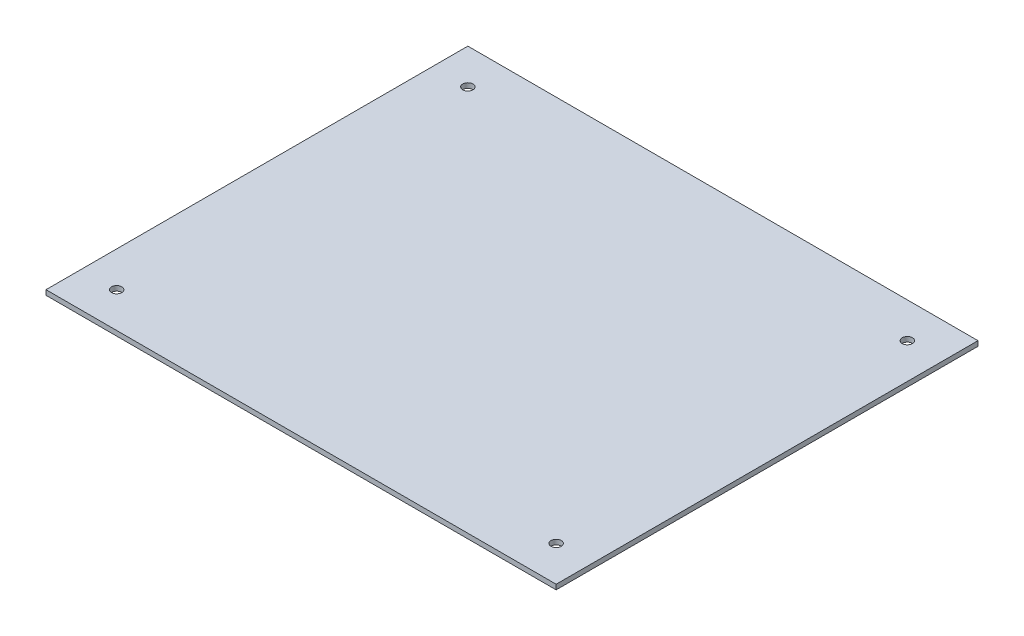
from build123d import *

# Parameters (mm, degrees)
SKETCH2_W           = 330.2
SKETCH2_H           = 273.05
BOSS_EXTRUDE1_DEPTH = 3.175
SKETCH3_R           = 3.302
CUT_EXTRUDE1_DEPTH  = 215.259576799


with BuildPart() as part:
    # Sketch2 → Boss-Extrude1 (new body)
    with BuildSketch(Plane(origin=(0, 0, 0), x_dir=(1, 0, 0), z_dir=(0, 1, 0))):
        Rectangle(SKETCH2_W, SKETCH2_H)
    extrude(amount=BOSS_EXTRUDE1_DEPTH)

    # Sketch3 → Cut-Extrude1 (cut, through all)
    with BuildSketch(Plane(origin=(0, 3.175, 0), x_dir=(1, 0, 0), z_dir=(0, 1, 0))):
        with Locations(Location((-142.24, -113.665, 0), (0, 0, 270))):
            Circle(SKETCH3_R)
        with Locations(Location((-142.24, 113.665, 0), (0, 0, 270))):
            Circle(SKETCH3_R)
        with Locations(Location((142.24, -113.665, 0), (0, 0, 270))):
            Circle(SKETCH3_R)
        with Locations(Location((142.24, 113.665, 0), (0, 0, 270))):
            Circle(SKETCH3_R)
    extrude(amount=-CUT_EXTRUDE1_DEPTH, mode=Mode.SUBTRACT)


solid = part.part
